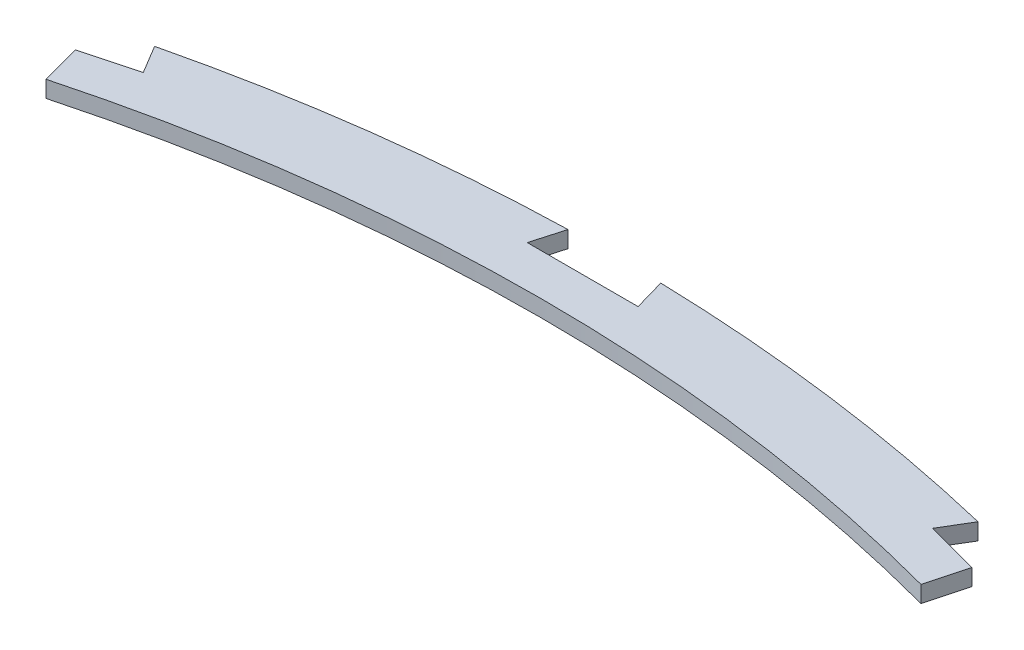
from build123d import *

# Parameters (mm, degrees)
BOSS_EXTRUDE1_DEPTH = 9


with BuildPart() as part:
    # Sketch1 → Boss-Extrude1 (new body)
    with BuildSketch(Plane(origin=(0, 0, 0), x_dir=(1, 0, 0), z_dir=(0, 1, 0))):
        with BuildLine():
            Line((-242.642854784, 905.555462146), (-236.819426269, 883.822131054))
            ThreePointArc((-236.819426269, 883.822131055), (0, 915), (236.819426269, 883.822131055))
            Line((236.819426269, 883.822131054), (242.642854784, 905.555462146))
            Line((242.642854784, 905.555462146), (213.665079995, 913.320033499))
            Line((213.665079995, 913.320033499), (222.84769118, 928.635507902))
            ThreePointArc((222.84769118, 928.635507902), (124.65251357, 946.829842612), (25.094215164, 954.670246926))
            Line((25.094215164, 954.670246926), (30, 937.5))
            Line((30, 937.5), (-30, 937.5))
            Line((-30, 937.5), (-25.094215164, 954.670246926))
            ThreePointArc((-25.094215164, 954.670246926), (-124.65251357, 946.829842612), (-222.84769118, 928.635507902))
            Line((-222.84769118, 928.635507902), (-213.665079995, 913.320033499))
            Line((-213.665079995, 913.320033499), (-242.642854784, 905.555462146))
        make_face()
    extrude(amount=BOSS_EXTRUDE1_DEPTH)


solid = part.part
